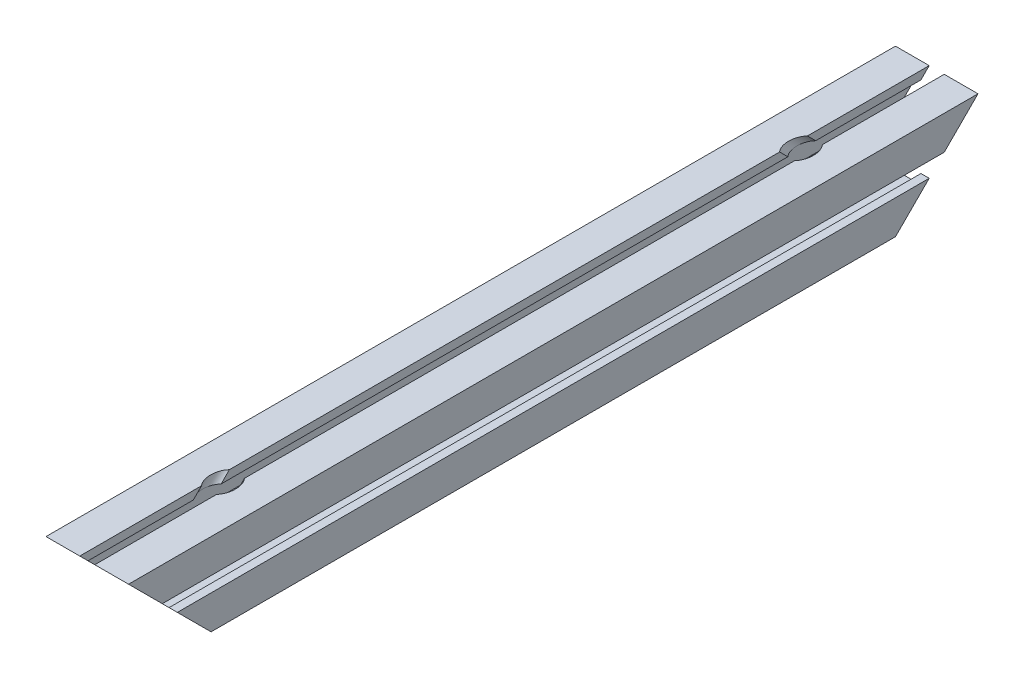
from build123d import *

# Parameters (mm, degrees)
EXTRUDE1_DEPTH      = 231.577470839
EXTRUDE1_DEPTH_BACK = 231.577470839
SKETCH1_R           = 6
SKETCH1_R_2         = 3.75
EXTRUDE2_DEPTH      = 237.979693223
SKETCH3_R           = 4.25
EXTRUDE3_DEPTH      = 361.026657911
SKETCH4_R           = 6.75
SKETCH4_R_2         = 4.25
EXTRUDE4_DEPTH      = 341.505319351


with BuildPart() as part:
    # Sketch1 → Extrude1 (new, two sides: drawn at the far end of the back side and taken through both)
    with BuildSketch(Plane.XY.offset(-EXTRUDE1_DEPTH_BACK)):
        Polygon((-18, -4.1), (-22.5, -4.1), (-22.5, -22.5), (-4.1, -22.5), (-4.1, -18), (-6.8, -18), (-6.8, -9.5), (-4.5, -7.2), (4.5, -7.2), (6.8, -9.5), (6.8, -18), (4.1, -18), (4.1, -22.5), (22.5, -22.5), (22.5, -4.1), (18, -4.1), (18, -6.8), (9.5, -6.8), (7.2, -4.5), (7.2, 4.5), (9.5, 6.8), (18, 6.8), (18, 4.1), (22.5, 4.1), (22.5, 22.5), (4.1, 22.5), (4.1, 18), (6.8, 18), (6.8, 9.5), (4.5, 7.2), (-4.5, 7.2), (-6.8, 9.5), (-6.8, 18), (-4.1, 18), (-4.1, 22.5), (-22.5, 22.5), (-22.5, 4.1), (-18, 4.1), (-18, 6.8), (-9.5, 6.8), (-7.2, 4.5), (-7.2, -4.5), (-9.5, -6.8), (-18, -6.8), align=None)
        with Locations((14.65, -14.65)):
            Circle(SKETCH1_R, mode=Mode.SUBTRACT)
        with Locations((-14.65, -14.65)):
            Circle(SKETCH1_R, mode=Mode.SUBTRACT)
        Circle(SKETCH1_R_2, mode=Mode.SUBTRACT)
        with Locations((14.65, 14.65)):
            Circle(SKETCH1_R, mode=Mode.SUBTRACT)
        with Locations((-14.65, 14.65)):
            Circle(SKETCH1_R, mode=Mode.SUBTRACT)
    extrude(amount=EXTRUDE1_DEPTH + EXTRUDE1_DEPTH_BACK)

    # Sketch2 → Extrude2 (cut, through all)
    with BuildSketch(Plane(origin=(22.5, 0, 0), x_dir=(0, 0, -1), z_dir=(1, 0, 0))):
        Polygon((-213.177470839, 4.1), (-231.577470839, 4.1), (-231.577470839, -22.5), (-186.577470839, -22.5), align=None)
        Polygon((-231.577470839, 22.5), (-231.577470839, 4.1), (-213.177470839, 4.1), align=None)
        Polygon((231.577470839, 4.1), (213.177470839, 4.1), (186.577470839, -22.5), (231.577470839, -22.5), align=None)
        Polygon((231.577470839, 22.5), (213.177470839, 4.1), (231.577470839, 4.1), align=None)
    extrude(amount=-EXTRUDE2_DEPTH, mode=Mode.SUBTRACT)

    # Sketch3 → Extrude3 (cut, through all)
    with BuildSketch(Plane(origin=(0, -104.538735419, 104.538735419), x_dir=(1, 0, 0), z_dir=(0, -0.707106781186557, 0.7071067811865381))):
        with Locations(Location((0, 127.335902577, 0), (0, 0, 90))):
            Circle(SKETCH3_R)
    extrude3 = extrude(amount=-EXTRUDE3_DEPTH, mode=Mode.SUBTRACT)

    # Sketch4 → Extrude4 (cut, through all)
    with BuildSketch(Plane(origin=(0, -89.272300014, 89.272300014), x_dir=(1, 0, 0), z_dir=(0, -0.707106781186557, 0.7071067811865381))):
        with Locations(Location((0, 127.335902577, 0), (0, 0, 270))):
            Circle(SKETCH4_R)
        with Locations(Location((0, 127.335902577, 0), (0, 0, 329.881821744))):
            Circle(SKETCH4_R_2, mode=Mode.SUBTRACT)
    extrude4 = extrude(amount=-EXTRUDE4_DEPTH, mode=Mode.SUBTRACT)

    # Mirror1: Extrude3, Extrude4 across plane
    add(extrude3.mirror(Plane.XY), mode=Mode.SUBTRACT)
    add(extrude4.mirror(Plane.XY), mode=Mode.SUBTRACT)


solid = part.part
